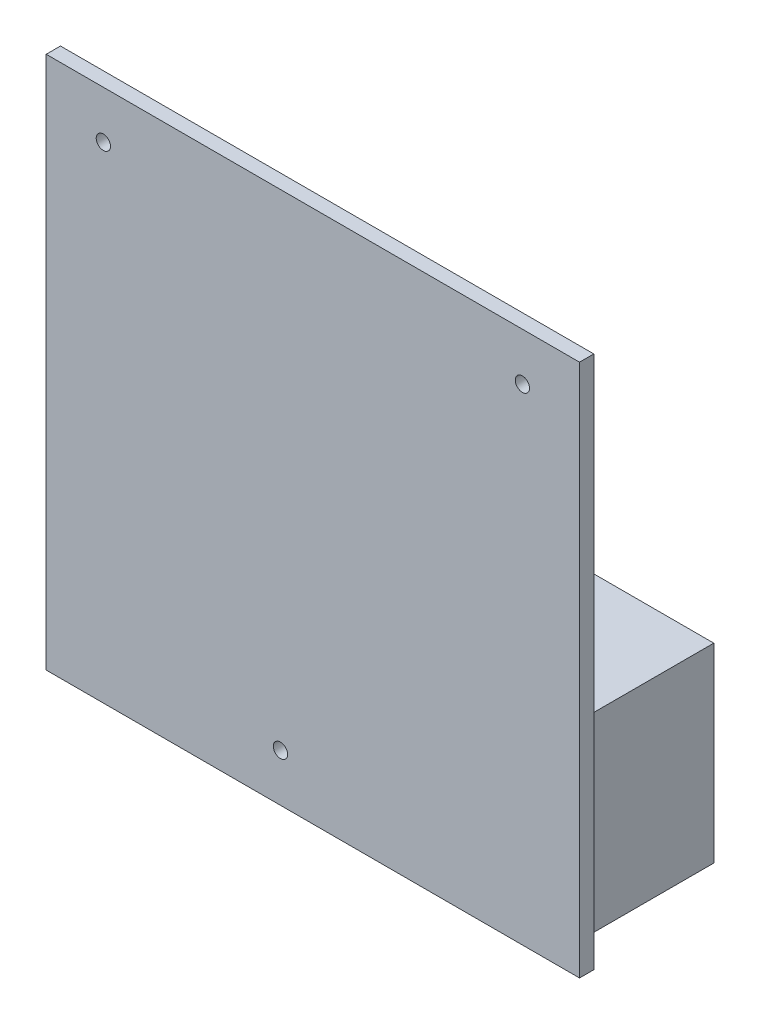
from build123d import *

# Parameters (mm, degrees)
CROQUIS1_W              = 112
CROQUIS1_H              = 112
SALIENTE_EXTRUIR1_DEPTH = 3
CROQUIS2_W              = 50
CROQUIS2_H              = 40
SALIENTE_EXTRUIR2_DEPTH = 32
CROQUIS3_W              = 20
CROQUIS3_H              = 35
SALIENTE_EXTRUIR3_DEPTH = 18
CROQUIS4_W              = 17.5
CROQUIS4_H              = 30
CORTAR_EXTRUIR1_DEPTH   = 16
CORTAR_EXTRUIR2_DEPTH   = 46
CROQUIS6_R              = 1.5
CORTAR_EXTRUIR3_DEPTH   = 46
CROQUIS7_W              = 59.874802373
CROQUIS7_H              = 112
CORTAR_EXTRUIR4_DEPTH   = 160
CROQUIS8_W              = 8.646016203
CROQUIS8_H              = 112
CROQUIS8_W_2            = 3
CORTAR_EXTRUIR5_DEPTH   = 150


with BuildPart() as part:
    # Croquis1 → Saliente-Extruir1 (new body)
    with BuildSketch(Plane.XY):
        Rectangle(CROQUIS1_W, CROQUIS1_H)
    saliente_extruir1 = extrude(amount=SALIENTE_EXTRUIR1_DEPTH)

    # Croquis2 → Saliente-Extruir2 (add)
    with BuildSketch(Plane.XY.offset(3)):
        with Locations((24.197, -36)):
            Rectangle(CROQUIS2_W, CROQUIS2_H)
    saliente_extruir2 = extrude(amount=SALIENTE_EXTRUIR2_DEPTH)

    # Croquis3 → Saliente-Extruir3 (add)
    with BuildSketch(Plane.XY.offset(3)):
        with Locations((-42, 0)):
            Rectangle(CROQUIS3_W, CROQUIS3_H)
    saliente_extruir3 = extrude(amount=SALIENTE_EXTRUIR3_DEPTH)

    # Croquis4 → Cortar-Extruir1 (cut)
    with BuildSketch(Plane.XY.offset(21)):
        with Locations((-43.25, 0)):
            Rectangle(CROQUIS4_W, CROQUIS4_H)
    cortar_extruir1 = extrude(amount=-CORTAR_EXTRUIR1_DEPTH, mode=Mode.SUBTRACT)

    # Croquis5 → Cortar-Extruir2 (cut)
    with BuildSketch(Plane.XZ.offset(17.5)):
        Polygon((-52, 21), (-52, 11), (-34.000297752, 21), align=None)
    cortar_extruir2 = extrude(amount=-CORTAR_EXTRUIR2_DEPTH, mode=Mode.SUBTRACT)

    # Croquis6 → Cortar-Extruir3 (cut)
    with BuildSketch(Plane.XY.offset(3)):
        with Locations((-44, 46)):
            Circle(CROQUIS6_R)
        with Locations((44, 46)):
            Circle(CROQUIS6_R)
        with Locations((-6.803, -46)):
            Circle(CROQUIS6_R)
    cortar_extruir3 = extrude(amount=-CORTAR_EXTRUIR3_DEPTH, mode=Mode.SUBTRACT)

    # Simetría1: Saliente-Extruir1, Saliente-Extruir2, Saliente-Extruir3, Cortar-Extruir1, Cortar-Extruir2, Cortar-Extruir3 across plane
    add(saliente_extruir1.mirror(Plane(origin=(0, 0, 0), x_dir=(1, 0, 0), z_dir=(0, 0, -1))))
    add(saliente_extruir2.mirror(Plane(origin=(0, 0, 0), x_dir=(1, 0, 0), z_dir=(0, 0, -1))))
    add(saliente_extruir3.mirror(Plane(origin=(0, 0, 0), x_dir=(1, 0, 0), z_dir=(0, 0, -1))))
    add(cortar_extruir1.mirror(Plane(origin=(0, 0, 0), x_dir=(1, 0, 0), z_dir=(0, 0, -1))), mode=Mode.SUBTRACT)
    add(cortar_extruir2.mirror(Plane(origin=(0, 0, 0), x_dir=(1, 0, 0), z_dir=(0, 0, -1))), mode=Mode.SUBTRACT)
    add(cortar_extruir3.mirror(Plane(origin=(0, 0, 0), x_dir=(1, 0, 0), z_dir=(0, 0, -1))), mode=Mode.SUBTRACT)

    # Croquis7 → Cortar-Extruir4 (cut)
    with BuildSketch(Plane(origin=(56, 0, 0), x_dir=(0, 0, -1), z_dir=(1, 0, 0))):
        with Locations((-32.937401186, 0)):
            Rectangle(CROQUIS7_W, CROQUIS7_H)
    extrude(amount=-CORTAR_EXTRUIR4_DEPTH, mode=Mode.SUBTRACT)

    # Croquis8 → Cortar-Extruir5 (cut)
    with BuildSketch(Plane(origin=(56, 0, 0), x_dir=(0, 0, -1), z_dir=(1, 0, 0))):
        with Locations((-7.323008102, 0)):
            Rectangle(CROQUIS8_W, CROQUIS8_H)
        with Locations((-1.5, 0)):
            Rectangle(CROQUIS8_W_2, CROQUIS8_H)
    extrude(amount=-CORTAR_EXTRUIR5_DEPTH, mode=Mode.SUBTRACT)


solid = part.part
